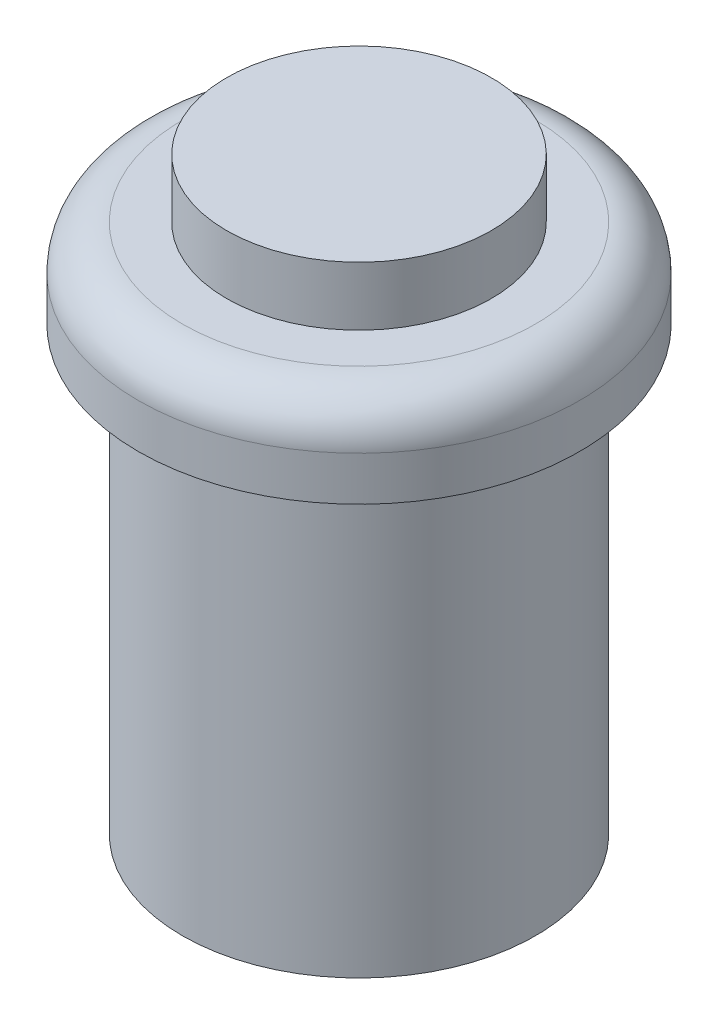
from build123d import *

# Parameters (mm, degrees)
SKETCH1_R           = 6
BOSS_EXTRUDE1_DEPTH = 15
SKETCH2_R           = 7.5
BOSS_EXTRUDE2_DEPTH = 3
SKETCH3_R           = 4.5
BOSS_EXTRUDE3_DEPTH = 2
FILLET1_R           = 1.5


with BuildPart() as part:
    # Sketch1 → Boss-Extrude1 (new body)
    with BuildSketch(Plane(origin=(0, 0, 0), x_dir=(1, 0, 0), z_dir=(0, 1, 0))):
        with Locations(Location((0, 0, 0), (0, 0, 270))):
            Circle(SKETCH1_R)
    extrude(amount=BOSS_EXTRUDE1_DEPTH)

    # Sketch2 → Boss-Extrude2 (add)
    with BuildSketch(Plane(origin=(0, 15, 0), x_dir=(1, 0, 0), z_dir=(0, 1, 0))):
        with Locations(Location((0, 0, 0), (0, 0, 270))):
            Circle(SKETCH2_R)
    extrude(amount=BOSS_EXTRUDE2_DEPTH)

    # Sketch3 → Boss-Extrude3 (add)
    with BuildSketch(Plane(origin=(0, 18, 0), x_dir=(1, 0, 0), z_dir=(0, 1, 0))):
        with Locations(Location((0, 0, 0), (0, 0, 270))):
            Circle(SKETCH3_R)
    extrude(amount=BOSS_EXTRUDE3_DEPTH)

    # Fillet1
    fillet1_edges = [part.edges().sort_by_distance(p)[0] for p in [
        (0, 18, -7.5),
    ]]
    fillet(fillet1_edges, radius=FILLET1_R)


solid = part.part
